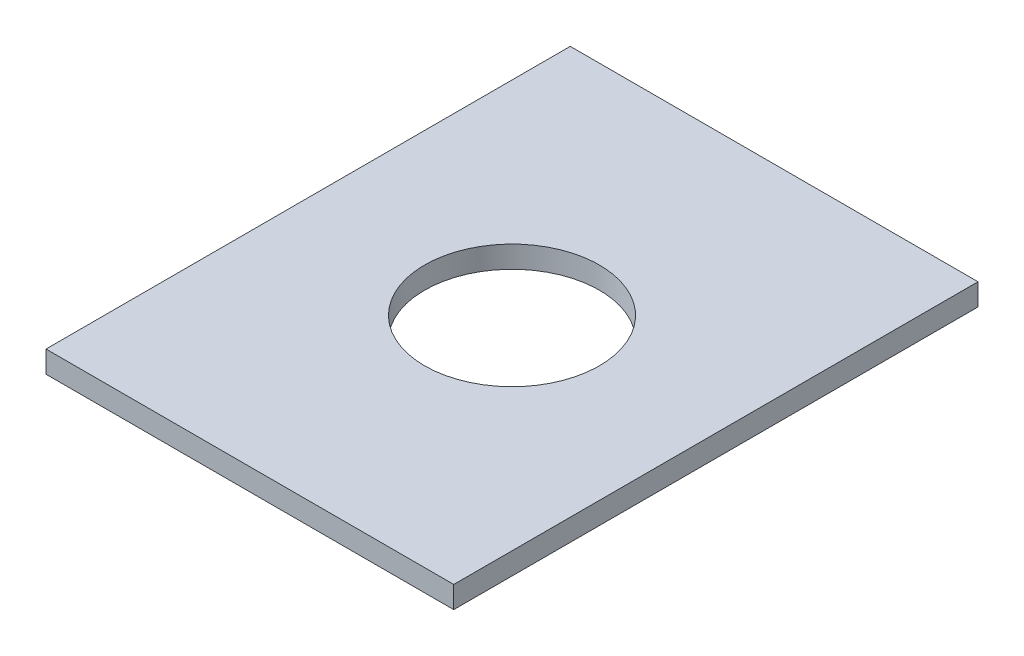
from build123d import *

# Parameters (mm, degrees)
SKETCH1_W           = 177.8
SKETCH1_H           = 228.6
BOSS_EXTRUDE1_DEPTH = 9.525
SKETCH2_R           = 38.1
CUT_EXTRUDE1_DEPTH  = 146.115215002


with BuildPart() as part:
    # Sketch1 → Boss-Extrude1 (new body)
    with BuildSketch(Plane(origin=(0, 0, 0), x_dir=(1, 0, 0), z_dir=(0, 1, 0))):
        Rectangle(SKETCH1_W, SKETCH1_H)
    extrude(amount=BOSS_EXTRUDE1_DEPTH)

    # Sketch2 → Cut-Extrude1 (cut, through all)
    with BuildSketch(Plane(origin=(0, 9.525, 0), x_dir=(1, 0, 0), z_dir=(0, 1, 0))):
        with Locations(Location((0, 0, 0), (0, 0, 270))):
            Circle(SKETCH2_R)
    extrude(amount=-CUT_EXTRUDE1_DEPTH, mode=Mode.SUBTRACT)


solid = part.part
